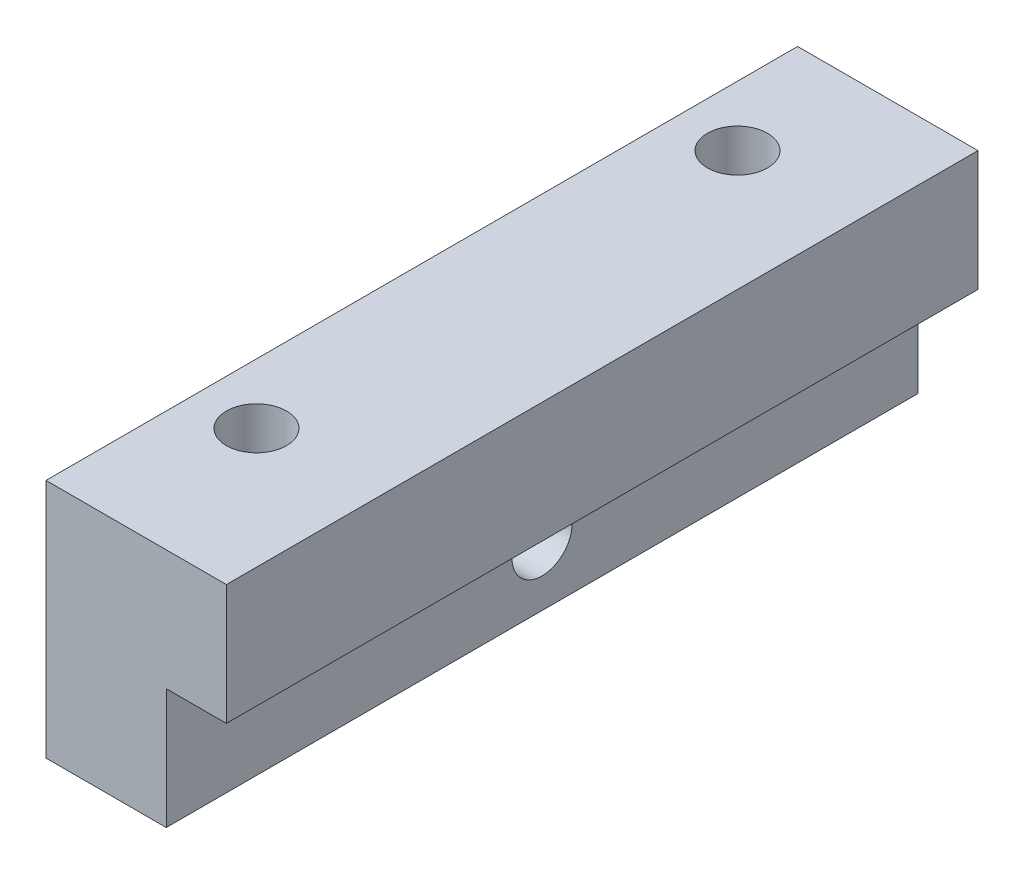
from build123d import *

# Parameters (mm, degrees)
BOSS_EXTRUDE1_DEPTH = 25
SKETCH2_R           = 2
CUT_EXTRUDE1_DEPTH  = 50
SKETCH4_R           = 2
CUT_EXTRUDE2_DEPTH  = 50


with BuildPart() as part:
    # Sketch1 → Boss-Extrude1 (new, symmetric)
    with BuildSketch(Plane.XY):
        Polygon((0, 0), (0, 16), (12, 16), (12, 8), (8, 8), (8, 0), align=None)
    extrude(amount=BOSS_EXTRUDE1_DEPTH, both=True)

    # Sketch2 → Cut-Extrude1 (cut)
    with BuildSketch(Plane.ZY):
        with Locations((0, 4)):
            Circle(SKETCH2_R)
    extrude(amount=-CUT_EXTRUDE1_DEPTH, mode=Mode.SUBTRACT)

    # Sketch4 → Cut-Extrude2 (cut)
    with BuildSketch(Plane(origin=(0, 16, 0), x_dir=(1, 0, 0), z_dir=(0, 1, 0))):
        with Locations(Location((4, 17, 0), (0, 0, 270))):
            Circle(SKETCH4_R)
        with Locations(Location((4, -15, 0), (0, 0, 270))):
            Circle(SKETCH4_R)
    extrude(amount=-CUT_EXTRUDE2_DEPTH, mode=Mode.SUBTRACT)


solid = part.part
